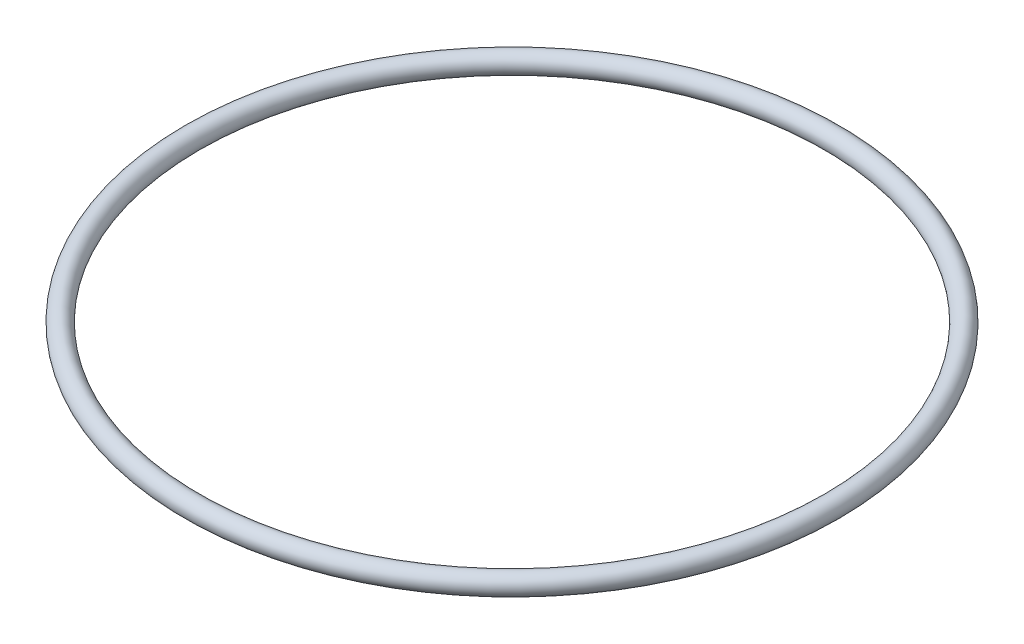
from build123d import *

# Parameters (mm, degrees)
SKETCH_2_R = 2


with BuildPart() as part:
    # ｽｲｰﾌﾟ1: sweep along a path in ｽｹｯﾁ1
    with BuildLine(Plane(origin=(0, 0, 0), x_dir=(1, 0, 0), z_dir=(0, 1, 0))) as sweep_1_path:
        CenterArc((0, 0), 63.66197725, 0, 360)
    # ｽｹｯﾁ2 → ｽｲｰﾌﾟ1 (sweep)
    with BuildSketch(Plane.XY):
        with Locations((63.66197725, 0)):
            Circle(SKETCH_2_R)
    sweep(path=sweep_1_path.line)


solid = part.part
